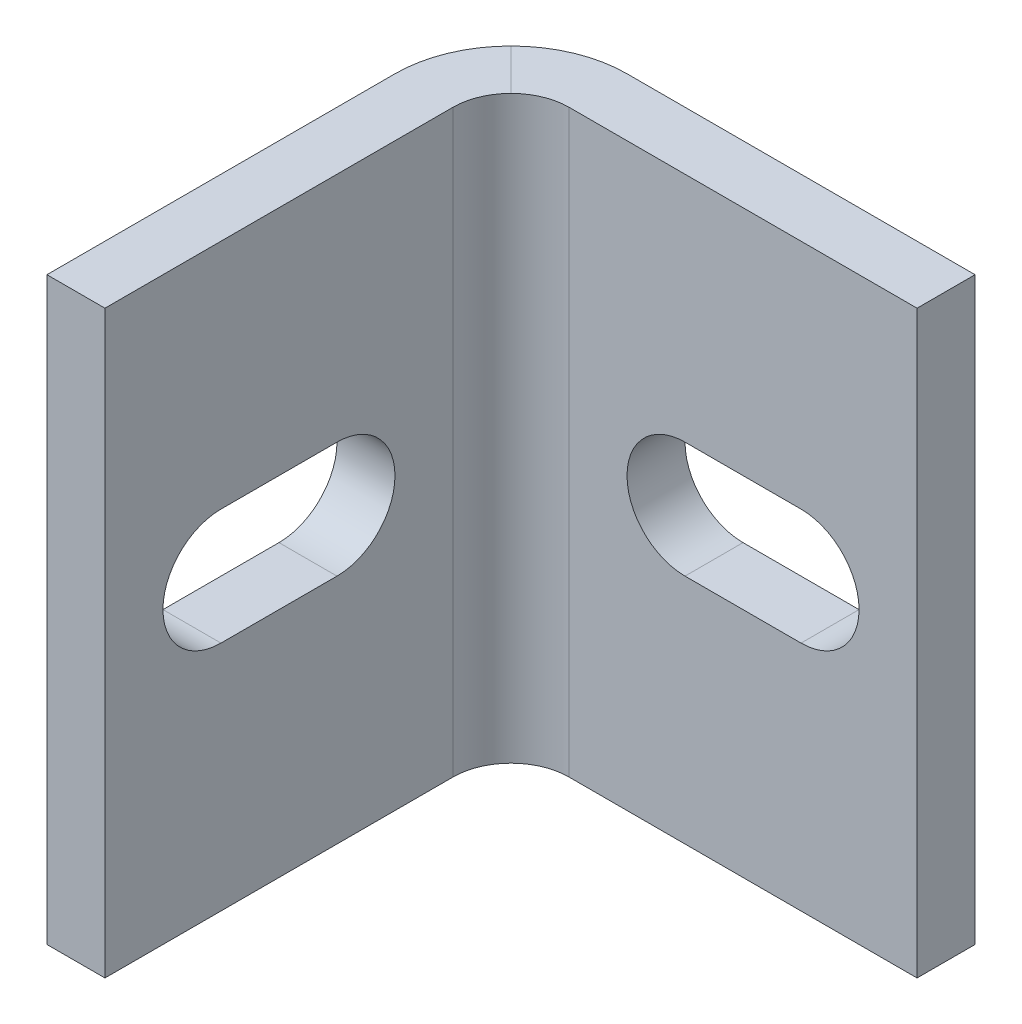
from build123d import *

# Parameters (mm, degrees)
SKETCH3_W          = 3.175
SKETCH3_H          = 31.75
FILLET1_R          = 3.175
FILLET2_R          = 6.35
CUT_EXTRUDE2_REACH = 41.273
CUT_EXTRUDE3_DEPTH = 38.297804895


with BuildPart() as part:
    # Sweep1: sweep along a path in Sketch4
    with BuildLine(Plane(origin=(0, 0, 0), x_dir=(1, 0, 0), z_dir=(0, 1, 0))) as sweep1_path:
        Line((0, 0), (0, 25.4))
        Line((0, 25.4), (25.4, 25.4))
    # Sketch3 → Sweep1 (sweep)
    with BuildSketch(Plane.XY):
        with Locations((1.5875, 0)):
            Rectangle(SKETCH3_W, SKETCH3_H)
    sweep(path=sweep1_path.line, transition=Transition.RIGHT)

    # Fillet1
    fillet1_edges = [part.edges().sort_by_distance(p)[0] for p in [
        (3.175, 0, -22.225),
    ]]
    fillet(fillet1_edges, radius=FILLET1_R)

    # Fillet2
    fillet2_edges = [part.edges().sort_by_distance(p)[0] for p in [
        (0, 0, -25.4),
    ]]
    fillet(fillet2_edges, radius=FILLET2_R)

    # Sketch6 → Cut-Extrude2 (cut, up to next)
    with BuildSketch(Plane(origin=(0, 0, 0), x_dir=(0, 0, -1), z_dir=(1, 0, 0)), mode=Mode.PRIVATE) as cut_extrude2_sk1:
        with BuildLine():
            Line((12.7, -3.175), (6.35, -3.175))
            ThreePointArc((6.35, -3.175), (3.175, 0), (6.35, 3.175))
            Line((6.35, 3.175), (12.7, 3.175))
            ThreePointArc((12.7, 3.175), (15.875, 0), (12.7, -3.175))
        make_face()
    cut_extrude2_tool1 = extrude(cut_extrude2_sk1.sketch, amount=CUT_EXTRUDE2_REACH, mode=Mode.PRIVATE) & part.part
    add(cut_extrude2_tool1.solids().sort_by_distance((0, 0, -9.525))[0], mode=Mode.SUBTRACT)

    # Sketch7 → Cut-Extrude3 (cut, through all)
    with BuildSketch(Plane.XY.offset(-22.225)):
        with BuildLine():
            Line((12.7, 3.175), (19.05, 3.175))
            ThreePointArc((19.05, 3.175), (22.225, 0), (19.05, -3.175))
            Line((19.05, -3.175), (12.7, -3.175))
            ThreePointArc((12.7, -3.175), (9.525, 0), (12.7, 3.175))
        make_face()
    extrude(amount=-CUT_EXTRUDE3_DEPTH, mode=Mode.SUBTRACT)


solid = part.part
